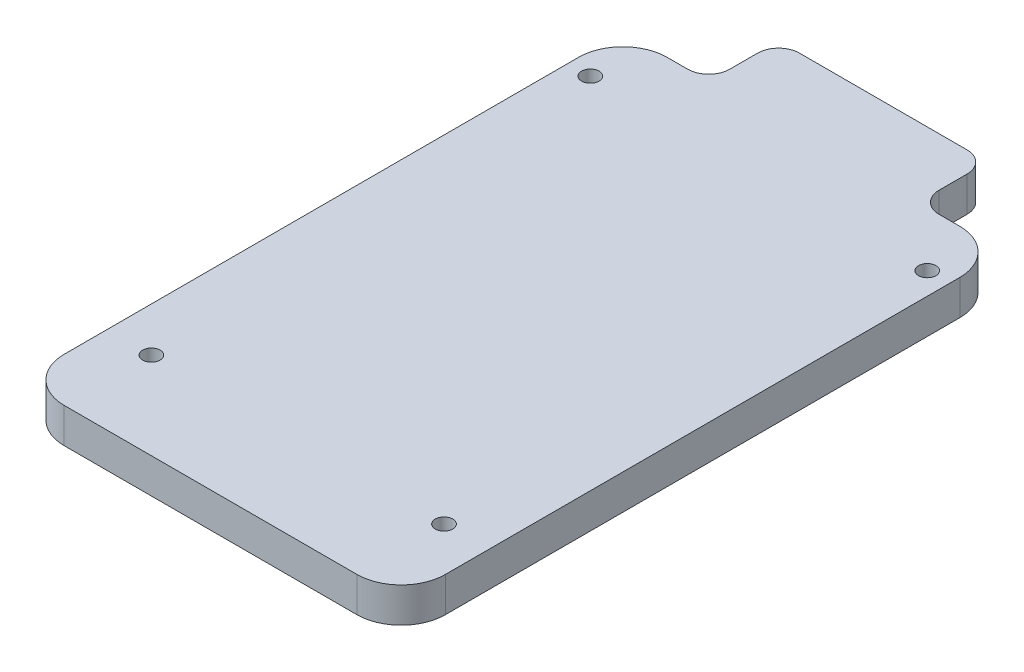
from build123d import *

# Parameters (mm, degrees)
BOSS_EXTRUDE1_DEPTH             = 5
TAP_DRILL_FOR_M3X0_5_TAP1_D     = 2.5
SKETCH5_W                       = 30
SKETCH5_H                       = 10
BOSS_EXTRUDE2_DEPTH             = 5
FILLET1_R                       = 3
TAP_DRILL_FOR_M3X0_5_TAP2_D     = 2.5
TAP_DRILL_FOR_M3X0_5_TAP2_DEPTH = 5
TAP_DRILL_FOR_M3X0_5_TAP2_TIP   = 0.751075774


with BuildPart() as part:
    # Sketch1 → Boss-Extrude1 (new body)
    with BuildSketch(Plane(origin=(0, 0, 0), x_dir=(1, 0, 0), z_dir=(0, 1, 0))):
        with BuildLine():
            Line((20.955, -43.18), (-20.955, -43.18))
            ThreePointArc((-20.955, -43.18), (-25.445128061, -41.320128061), (-27.305, -36.83))
            Line((-27.305, -36.83), (-27.305, 36.83))
            ThreePointArc((-27.305, 36.83), (-25.445128061, 41.320128061), (-20.955, 43.18))
            Line((-20.955, 43.18), (20.955, 43.18))
            ThreePointArc((20.955, 43.18), (25.445128061, 41.320128061), (27.305, 36.83))
            Line((27.305, 36.83), (27.305, -36.83))
            ThreePointArc((27.305, -36.83), (25.445128061, -41.320128061), (20.955, -43.18))
        make_face()
    extrude(amount=BOSS_EXTRUDE1_DEPTH)

    # Tap Drill for M3x0.5 Tap1 (through all)
    with Locations(Plane(origin=(0, 5, 0), x_dir=(1, 0, 0), z_dir=(0, 1, 0))):
        with Locations((-24.13, 35.345352113), (24.13, 35.345352113), (-20.955, -30.694647887), (20.955, -30.694647887)):
            Hole(TAP_DRILL_FOR_M3X0_5_TAP1_D / 2)

    # Sketch5 → Boss-Extrude2 (add)
    with BuildSketch(Plane(origin=(0, 5, 0), x_dir=(1, 0, 0), z_dir=(0, 1, 0))):
        with Locations((0, 48.18)):
            Rectangle(SKETCH5_W, SKETCH5_H)
    extrude(amount=-BOSS_EXTRUDE2_DEPTH)

    # Fillet1
    fillet1_edges = [part.edges().sort_by_distance(p)[0] for p in [
        (-15, 2.5, -43.18),
        (-15, 2.5, -53.18),
        (15, 2.5, -53.18),
        (15, 2.5, -43.18),
    ]]
    fillet(fillet1_edges, radius=FILLET1_R)

    # Tap Drill for M3x0.5 Tap2
    with Locations(Plane(origin=(0, 0, -53.18), x_dir=(-1, 0, 0), z_dir=(0, 0, -1))):
        with Locations((8, 1.5), (-8, 1.5)):
            Hole(TAP_DRILL_FOR_M3X0_5_TAP2_D / 2, depth=TAP_DRILL_FOR_M3X0_5_TAP2_DEPTH)
            with Locations((0, 0, -(TAP_DRILL_FOR_M3X0_5_TAP2_DEPTH + TAP_DRILL_FOR_M3X0_5_TAP2_TIP / 2))):  # 118° drill point
                Cone(0, TAP_DRILL_FOR_M3X0_5_TAP2_D / 2, TAP_DRILL_FOR_M3X0_5_TAP2_TIP, mode=Mode.SUBTRACT)


solid = part.part
